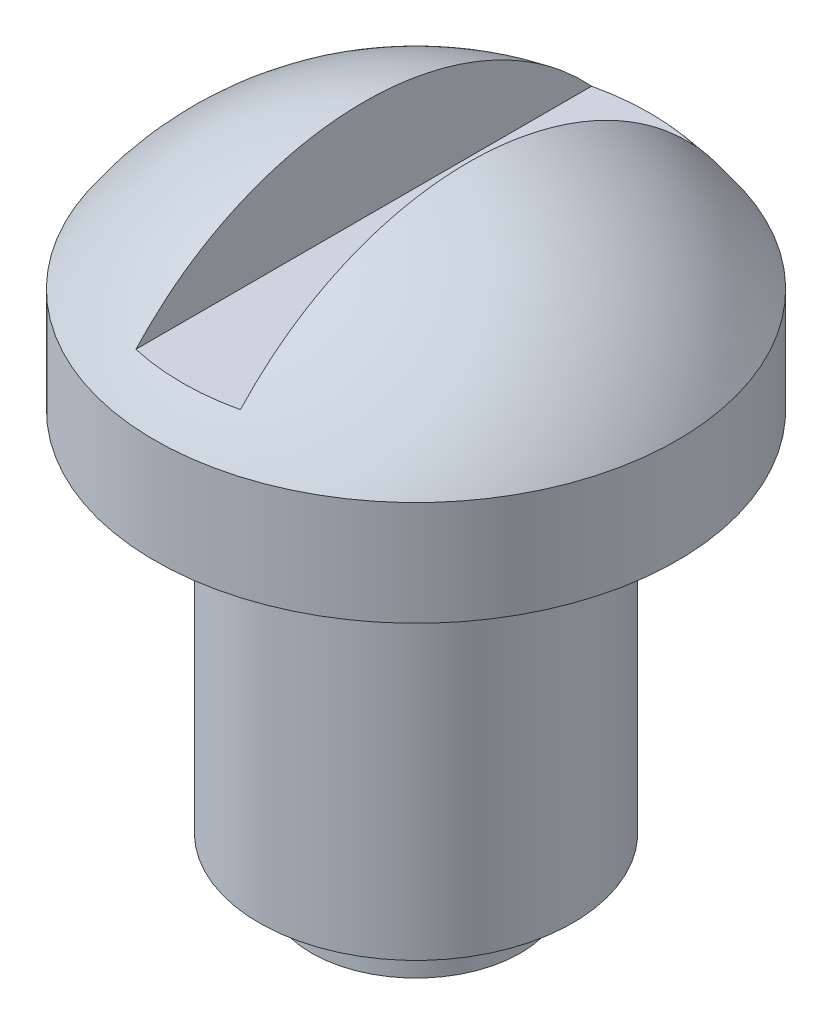
from build123d import *

# Parameters (mm, degrees)
CUT_EXTRUDE1_DEPTH      = 15.521294939
CUT_EXTRUDE1_DEPTH_BACK = 15.521294939
SKETCH2_W               = 2
SKETCH2_H               = 2


with BuildPart() as part:
    # Sketch1 → Revolve1 (revolve)
    with BuildSketch(Plane.XY, mode=Mode.PRIVATE) as revolve1_sk:
        with BuildLine():
            Line((2, 0), (2, 1))
            Line((2, 1), (3, 1))
            Line((3, 1), (3, 8))
            Line((3, 8), (5, 8))
            Line((5, 8), (5, 10))
            ThreePointArc((5, 10), (2.837274331, 11.970139283), (0, 12.68337521))
            Line((0, 12.68337521), (0, 0))
            Line((0, 0), (2, 0))
        make_face()
    revolve(revolve1_sk.sketch.rotate(Axis((0, 12.68337521, 0), (0, -1, 0)), 180), axis=Axis((0, 12.68337521, 0), (0, -1, 0)))

    # Sketch2 → Cut-Extrude1 (cut, two sides: drawn at the far end of the back side and taken through both)
    with BuildSketch(Plane.XY.offset(-CUT_EXTRUDE1_DEPTH_BACK)):
        with Locations((0, 11.68337521)):
            Rectangle(SKETCH2_W, SKETCH2_H)
    extrude(amount=CUT_EXTRUDE1_DEPTH + CUT_EXTRUDE1_DEPTH_BACK, mode=Mode.SUBTRACT)


solid = part.part
